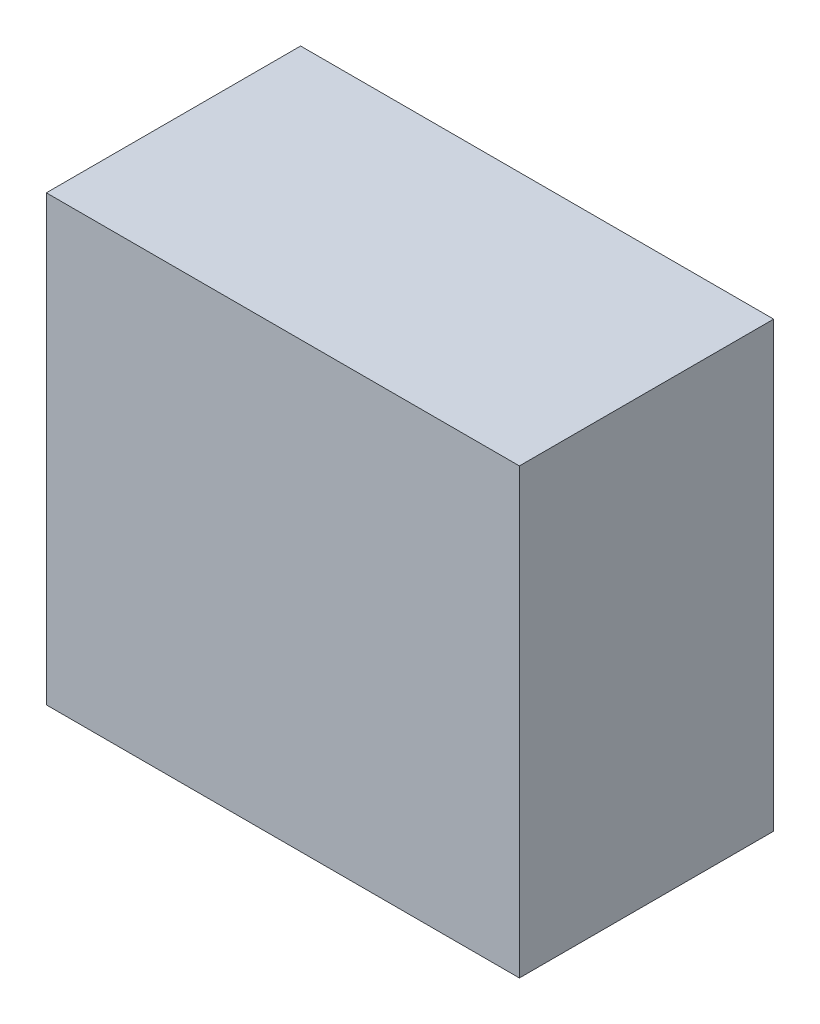
from build123d import *

# Parameters (mm, degrees)
SKETCH1_W           = 320
SKETCH1_H           = 172
BOSS_EXTRUDE1_DEPTH = 300


with BuildPart() as part:
    # Sketch1 → Boss-Extrude1 (new body)
    with BuildSketch(Plane(origin=(0, 0, 0), x_dir=(1, 0, 0), z_dir=(0, 1, 0))):
        Rectangle(SKETCH1_W, SKETCH1_H)
    extrude(amount=BOSS_EXTRUDE1_DEPTH)


solid = part.part
